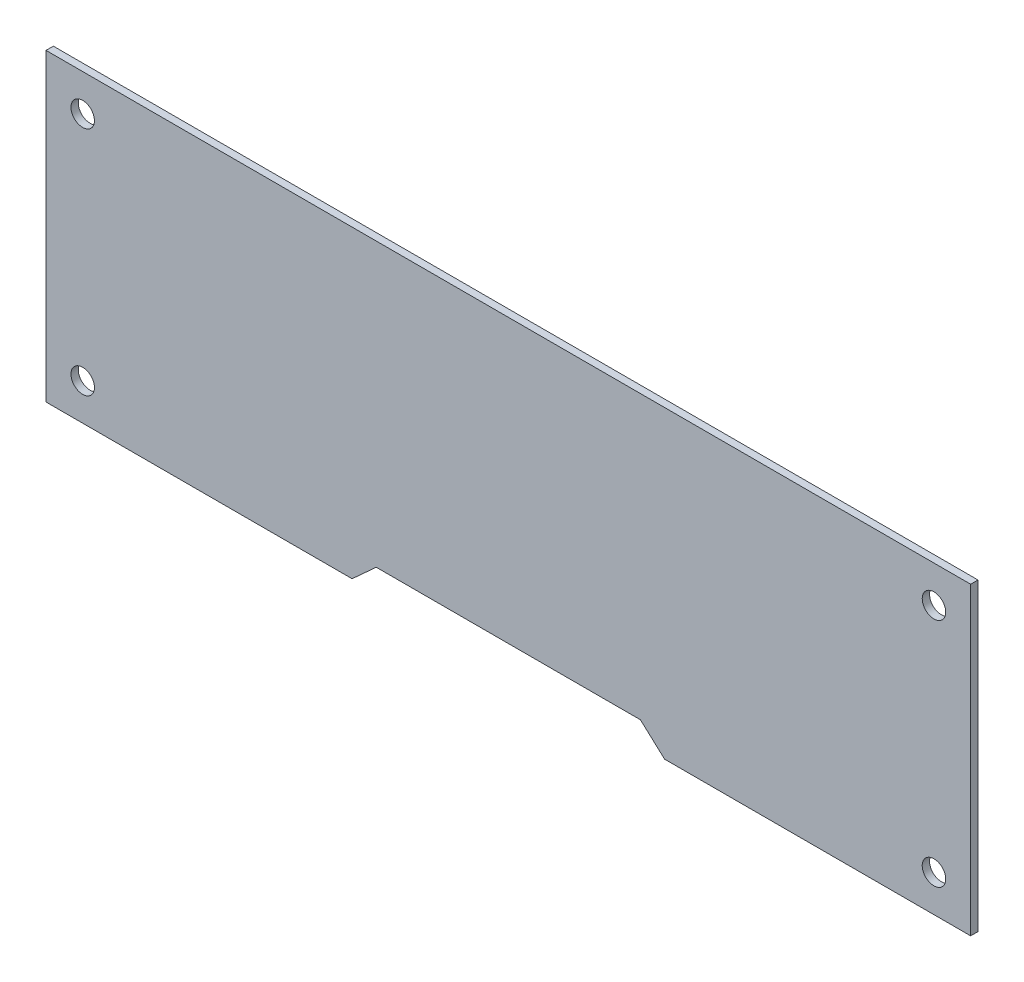
from build123d import *

# Parameters (mm, degrees)
SKETCH_1_W          = 126
SKETCH_1_H          = 41.5
EXTRUDE_1_DEPTH     = 1
SKETCH_2_R          = 1.6
CUT_EXTRUDE_1_DEPTH = 67.336735675
CUT_EXTRUDE_2_DEPTH = 67.336735675


with BuildPart() as part:
    # 草图1 → 凸台-拉伸1 (new body)
    with BuildSketch(Plane.XY):
        Rectangle(SKETCH_1_W, SKETCH_1_H)
    extrude(amount=EXTRUDE_1_DEPTH)

    # 草图2 → 切除-拉伸1 (cut, through all)
    with BuildSketch(Plane.XY.offset(1)):
        with Locations((-58, 15.75)):
            Circle(SKETCH_2_R)
        with Locations(Location((-58, -15.75, 0), (0, 0, 180))):
            Circle(SKETCH_2_R)
        with Locations((58, -15.75)):
            Circle(SKETCH_2_R)
        with Locations(Location((58, 15.75, 0), (0, 0, 180))):
            Circle(SKETCH_2_R)
    extrude(amount=-CUT_EXTRUDE_1_DEPTH, mode=Mode.SUBTRACT)

    # 草图3 → 切除-拉伸2 (cut, through all)
    with BuildSketch(Plane.XY.offset(1)):
        Polygon((-21.292219163, -20.75), (-18, -17.75), (18, -17.75), (21.292219163, -20.75), align=None)
    extrude(amount=-CUT_EXTRUDE_2_DEPTH, mode=Mode.SUBTRACT)


solid = part.part
